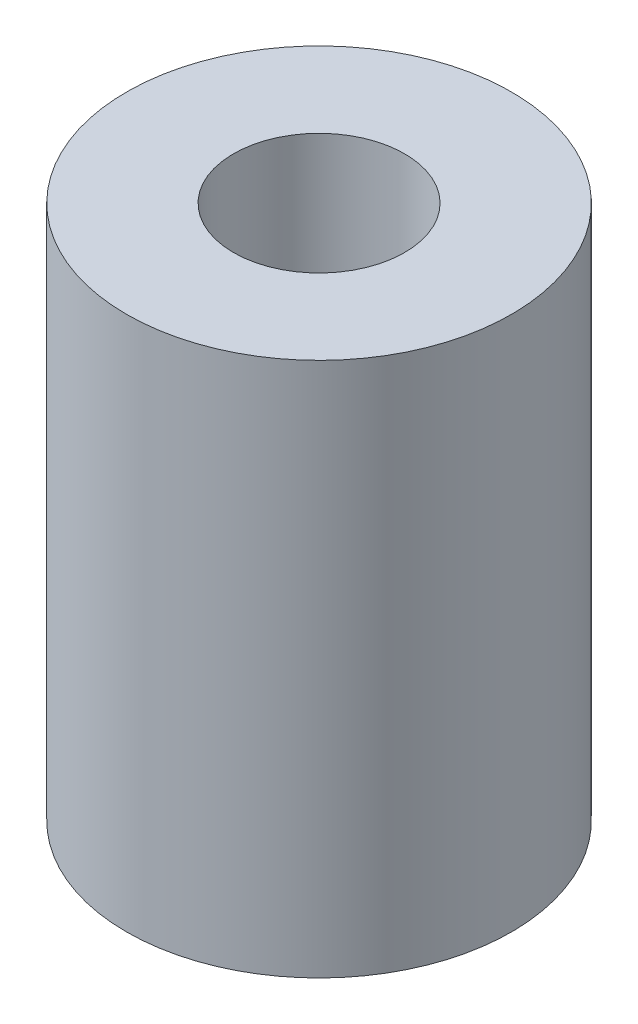
from build123d import *

# Parameters (mm, degrees)
SKETCH1_R           = 9
SKETCH1_R_2         = 4
BOSS_EXTRUDE1_DEPTH = 25


with BuildPart() as part:
    # Sketch1 → Boss-Extrude1 (new body)
    with BuildSketch(Plane(origin=(0, 0, 0), x_dir=(1, 0, 0), z_dir=(0, 1, 0))):
        with Locations(Location((0, 0, 0), (0, 0, 270))):
            Circle(SKETCH1_R)
        with Locations(Location((0, 0, 0), (0, 0, 270))):
            Circle(SKETCH1_R_2, mode=Mode.SUBTRACT)
    extrude(amount=BOSS_EXTRUDE1_DEPTH)


solid = part.part
